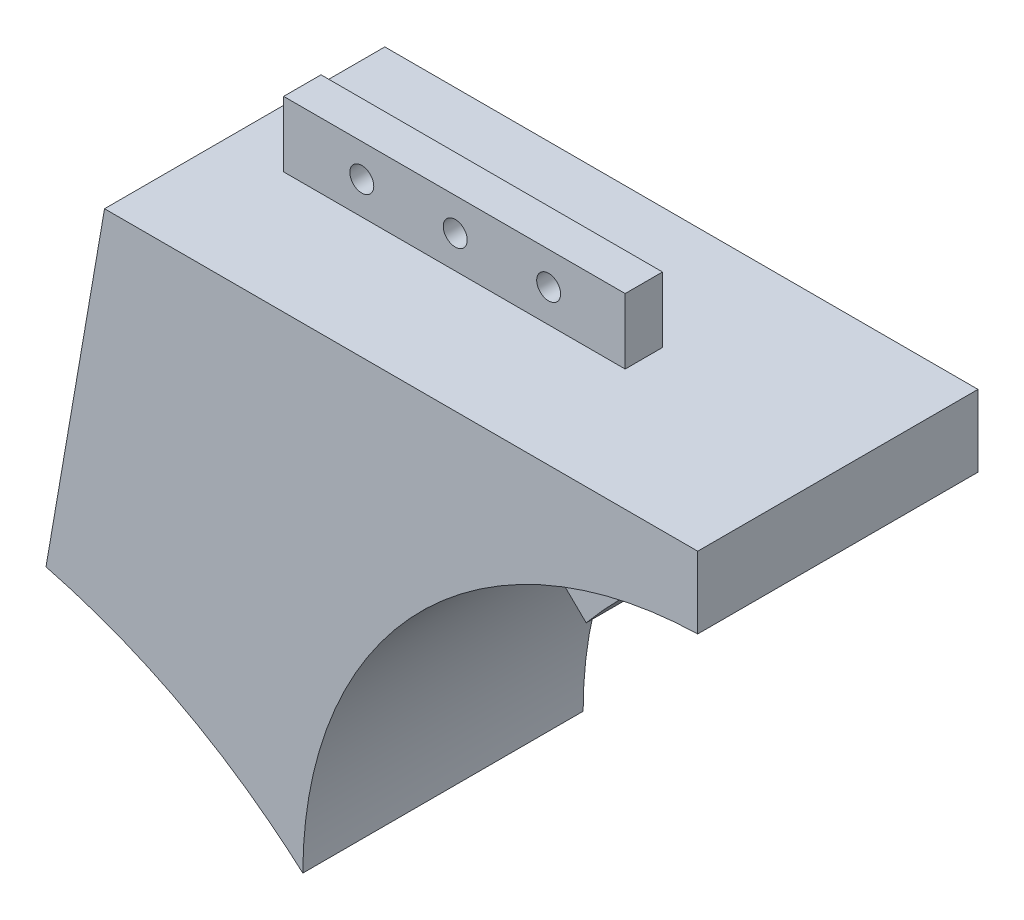
from build123d import *

# Parameters (mm, degrees)
RIGHT_MAIN_DEPTH    = 30
SKETCH2_R           = 2.5625
SKETCH2_R_2         = 2.563
RIGHTSCREWS_DEPTH   = 4
LEFT_MAIN_START     = -30
LEFT_MAIN_DEPTH     = 30
BOSS_EXTRUDE4_START = -4
LEFTSCRWS_R         = 2.5625
LEFTSCRWS_R_2       = 2.563
BOSS_EXTRUDE4_DEPTH = 4


with BuildPart() as part:
    # Sketch1 → right_main (new body)
    with BuildSketch(Plane.XY):
        with BuildLine():
            Line((107.405043491, 43.874842), (94.874715104, -28.778692489))
            add(Edge.make_bspline(
                [(94.874715104, -28.778692489), (125.81929731, -36.765852729), (149.855864514, -58.067716007)],
                knots=[0, 0, 0, 1, 1, 1], degree=2))
            Line((149.855864514, -58.067716007), (149.855864514, 43.874842))
            Line((149.855864514, 43.874842), (107.405043491, 43.874842))
        make_face()
        Polygon((149.855864514, 43.874842), (149.855864514, 28.52351163), (234.383754043, 28.52351163), (234.383754043, 43.874842), (192.853964769, 43.874842), align=None)
        with BuildLine():
            Line((149.855864514, 28.52351163), (149.855864514, -58.067716007))
            ThreePointArc((149.855864514, -58.067716007), (156.250771623, -25.404082318), (174.491218383, 2.436426025))
            ThreePointArc((174.491218383, 2.436426025), (201.883813055, 21.342868309), (234.383754043, 28.52351163))
            Line((234.383754043, 28.52351163), (149.855864514, 28.52351163))
        make_face()
    extrude(amount=RIGHT_MAIN_DEPTH)

    # Sketch2 → rightScrews (add)
    # profile 1 of 3: a face of its own
    with BuildSketch(Plane.XY):
        Polygon((119.747446117, 43.874842), (149.855864514, 43.874842), (192.853964769, 43.874842), (192.853964769, 57.874842), (119.747446117, 57.874842), align=None)
        with Locations((136.47520886, 50.874842)):
            Circle(SKETCH2_R, mode=Mode.SUBTRACT)
        with Locations((156.47520886, 50.874842)):
            Circle(SKETCH2_R, mode=Mode.SUBTRACT)
        with Locations((176.47520886, 50.874842)):
            Circle(SKETCH2_R, mode=Mode.SUBTRACT)
    # profile 2 of 3: a face of its own
    with BuildSketch(Plane.XY):
        with BuildLine():
            ThreePointArc((234.383754043, 28.52351163), (201.883813055, 21.342868309), (174.491218383, 2.436426025))
            Line((174.491218383, 2.436426025), (184.509352234, -7.342990836))
            add(Edge.make_bspline(
                [(184.509352234, -7.342990836), (204.930565052, 17.078226951), (234.383754043, 28.52351163)],
                knots=[0, 0, 0, 1, 1, 1], degree=2))
        make_face()
        with Locations((185.50732181, 3.700386733)):
            Circle(SKETCH2_R_2, mode=Mode.SUBTRACT)
    # profile 3 of 3: a face of its own
    with BuildSketch(Plane.XY):
        with BuildLine():
            Line((130.072927577, -58.067716007), (149.855864514, -58.067716007))
            add(Edge.make_bspline(
                [(101.184495321, -30.567929509), (128.298436124, -38.962933352), (149.855864514, -58.067716007)],
                knots=[0.103140303, 0.103140303, 0.103140303, 1, 1, 1], degree=2))
            Line((101.184495321, -30.567929509), (97.320282555, -43.048452225))
            Line((97.320282555, -43.048452225), (130.072927577, -58.067716007))
        make_face()
        with Locations((128.167744084, -49.493161828)):
            Circle(SKETCH2_R, mode=Mode.SUBTRACT)
        with Locations((109.079068542, -40.739735867)):
            Circle(SKETCH2_R, mode=Mode.SUBTRACT)
    extrude(amount=RIGHTSCREWS_DEPTH)

    # Sketch3 → left_main (add)
    with BuildSketch(Plane.XY.offset(LEFT_MAIN_START)):
        Polygon((149.855864514, 43.874842), (149.855864514, 28.52351163), (234.383754043, 28.52351163), (234.383754043, 43.874842), (192.853964769, 43.874842), align=None)
        with BuildLine():
            Line((107.405043491, 43.874842), (94.874715104, -28.778692489))
            add(Edge.make_bspline(
                [(94.874715104, -28.778692489), (125.81929731, -36.765852729), (149.855864514, -58.067716007)],
                knots=[0, 0, 0, 1, 1, 1], degree=2))
            Line((149.855864514, -58.067716007), (149.855864514, 43.874842))
            Line((149.855864514, 43.874842), (107.405043491, 43.874842))
        make_face()
        with BuildLine():
            Line((149.855864514, 28.52351163), (149.855864514, -58.067716007))
            ThreePointArc((149.855864514, -58.067716007), (156.250771623, -25.404082318), (174.491218383, 2.436426025))
            ThreePointArc((174.491218383, 2.436426025), (201.883813055, 21.342868309), (234.383754043, 28.52351163))
            Line((234.383754043, 28.52351163), (149.855864514, 28.52351163))
        make_face()
    extrude(amount=LEFT_MAIN_DEPTH)

    # leftScrws → Boss-Extrude4 (add)
    # profile 1 of 3: a face of its own
    with BuildSketch(Plane.XY.offset(BOSS_EXTRUDE4_START)):
        Polygon((119.747446117, 43.874842), (149.855864514, 43.874842), (192.853964769, 43.874842), (192.853964769, 57.874842), (119.747446117, 57.874842), align=None)
        with Locations((136.47520886, 50.874842)):
            Circle(LEFTSCRWS_R, mode=Mode.SUBTRACT)
        with Locations((156.47520886, 50.874842)):
            Circle(LEFTSCRWS_R, mode=Mode.SUBTRACT)
        with Locations((176.47520886, 50.874842)):
            Circle(LEFTSCRWS_R, mode=Mode.SUBTRACT)
    # profile 2 of 3: a face of its own
    with BuildSketch(Plane.XY.offset(BOSS_EXTRUDE4_START)):
        with BuildLine():
            Line((130.072927577, -58.067716007), (149.855864514, -58.067716007))
            add(Edge.make_bspline(
                [(101.184495321, -30.567929509), (128.298436124, -38.962933352), (149.855864514, -58.067716007)],
                knots=[0.103140303, 0.103140303, 0.103140303, 1, 1, 1], degree=2))
            Line((101.184495321, -30.567929509), (97.320282555, -43.048452225))
            Line((97.320282555, -43.048452225), (130.072927577, -58.067716007))
        make_face()
        with Locations((128.167744084, -49.493161828)):
            Circle(LEFTSCRWS_R, mode=Mode.SUBTRACT)
        with Locations((109.079068542, -40.739735867)):
            Circle(LEFTSCRWS_R, mode=Mode.SUBTRACT)
    # profile 3 of 3: a face of its own
    with BuildSketch(Plane.XY.offset(BOSS_EXTRUDE4_START)):
        with BuildLine():
            ThreePointArc((234.383754043, 28.52351163), (201.883813055, 21.342868309), (174.491218383, 2.436426025))
            Line((174.491218383, 2.436426025), (184.509352234, -7.342990836))
            add(Edge.make_bspline(
                [(184.509352234, -7.342990836), (204.930565052, 17.078226951), (234.383754043, 28.52351163)],
                knots=[0, 0, 0, 1, 1, 1], degree=2))
        make_face()
        with Locations((185.50732181, 3.700386733)):
            Circle(LEFTSCRWS_R_2, mode=Mode.SUBTRACT)
    extrude(amount=BOSS_EXTRUDE4_DEPTH)


solid = part.part
